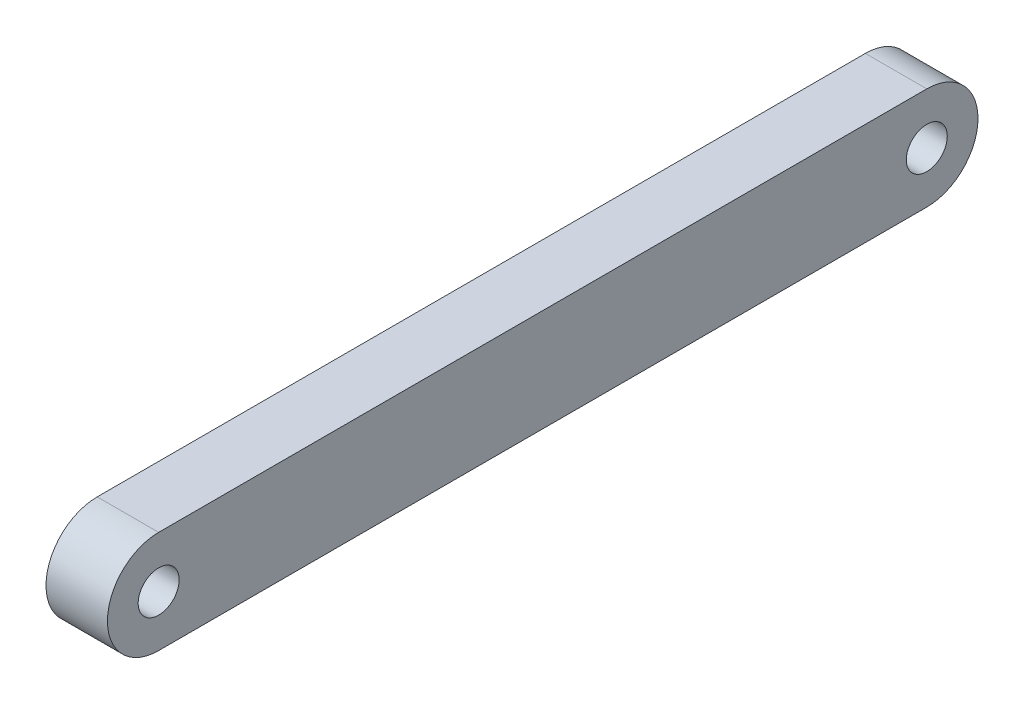
from build123d import *

# Parameters (mm, degrees)
EXTRUDE_1_DEPTH     = 6
SKETCH_2_R          = 2
CUT_EXTRUDE_1_DEPTH = 81.380345856


with BuildPart() as part:
    # 草图1 → 凸台-拉伸1 (new body)
    with BuildSketch(Plane(origin=(0, 0, 0), x_dir=(0, 0, -1), z_dir=(1, 0, 0))):
        with BuildLine():
            Line((0, 5), (75, 5))
            ThreePointArc((75, 5), (80, 0), (75, -5))
            Line((75, -5), (0, -5))
            ThreePointArc((0, -5), (-5, 0), (0, 5))
        make_face()
    extrude(amount=EXTRUDE_1_DEPTH)

    # 草图2 → 切除-拉伸1 (cut, through all)
    with BuildSketch(Plane(origin=(6, 0, 0), x_dir=(0, 0, -1), z_dir=(1, 0, 0))):
        with Locations((75, 0)):
            Circle(SKETCH_2_R)
        Circle(SKETCH_2_R)
    extrude(amount=-CUT_EXTRUDE_1_DEPTH, mode=Mode.SUBTRACT)


solid = part.part
